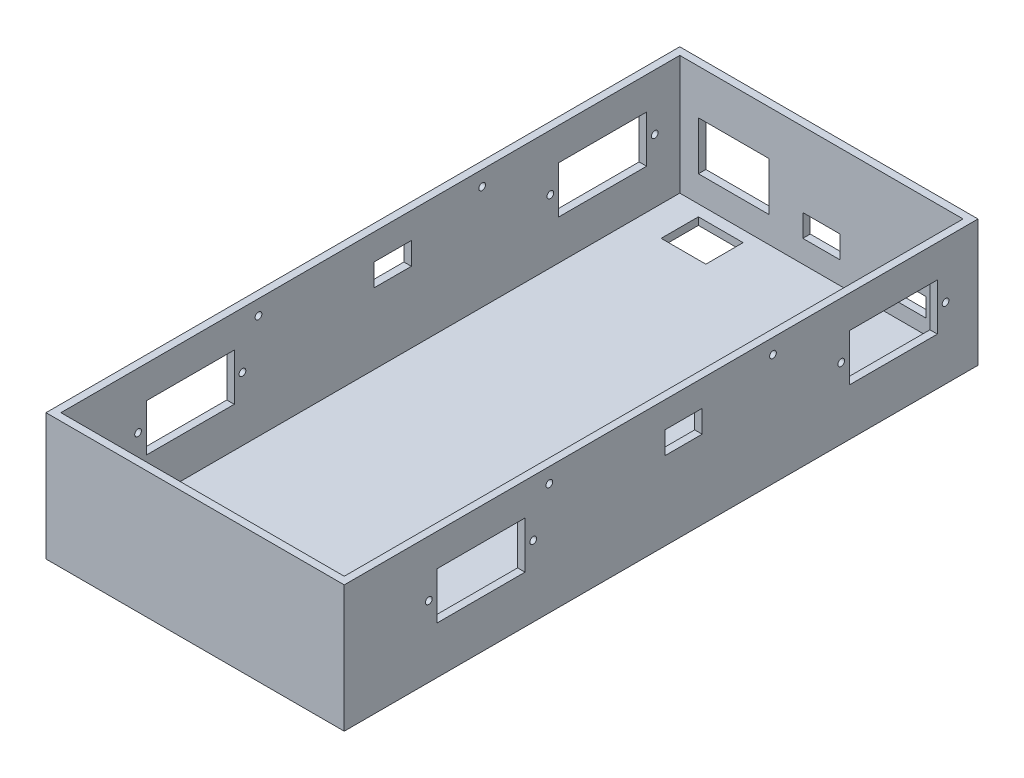
from build123d import *

# Parameters (mm, degrees)
BOSS_EXTRUDE1_START  = -85
SKETCH1_W            = 80
SKETCH1_H            = 34
BOSS_EXTRUDE1_DEPTH  = 170
BOSS_EXTRUDE2_START  = -83
SKETCH2_W            = 76
SKETCH2_H            = 38
BOSS_EXTRUDE2_DEPTH  = 166
BOSS_EXTRUDE3_START  = -45
SKETCH3_W            = 23.6
SKETCH3_H            = 12.6
BOSS_EXTRUDE3_DEPTH  = 90
BOSS_EXTRUDE4_START  = -45
SKETCH4_R            = 0.9
BOSS_EXTRUDE4_DEPTH  = 90
BOSS_EXTRUDE5_START  = -45
SKETCH5_R            = 0.9
BOSS_EXTRUDE5_DEPTH  = 90
BOSS_EXTRUDE6_START  = -45
SKETCH6_W            = 23.6
SKETCH6_H            = 12.6
BOSS_EXTRUDE6_DEPTH  = 90
BOSS_EXTRUDE7_START  = -45
SKETCH7_R            = 0.9
BOSS_EXTRUDE7_DEPTH  = 90
BOSS_EXTRUDE8_START  = -45
SKETCH8_R            = 0.9
BOSS_EXTRUDE8_DEPTH  = 90
BOSS_EXTRUDE9_START  = -45
SKETCH9_W            = 10
SKETCH9_H            = 6
BOSS_EXTRUDE9_DEPTH  = 90
BOSS_EXTRUDE10_START = -90
SKETCH10_W           = 10
SKETCH10_H           = 6
BOSS_EXTRUDE10_DEPTH = 10
BOSS_EXTRUDE11_START = -90
SKETCH11_W           = 10
SKETCH11_H           = 5
BOSS_EXTRUDE11_DEPTH = 10
BOSS_EXTRUDE12_START = -90
SKETCH12_W           = 19
SKETCH12_H           = 13
BOSS_EXTRUDE12_DEPTH = 10
BOSS_EXTRUDE13_START = 62
SKETCH13_W           = 12
SKETCH13_H           = 4
BOSS_EXTRUDE13_DEPTH = 10
BOSS_EXTRUDE14_START = 62
SKETCH14_W           = 12
SKETCH14_H           = 4
BOSS_EXTRUDE14_DEPTH = 10
BOSS_EXTRUDE15_START = -80
SKETCH15_W           = 12
SKETCH15_H           = 4
BOSS_EXTRUDE15_DEPTH = 10
BOSS_EXTRUDE16_START = -45
SKETCH16_R           = 0.9
BOSS_EXTRUDE16_DEPTH = 90
BOSS_EXTRUDE17_START = -45
SKETCH17_R           = 0.9
BOSS_EXTRUDE17_DEPTH = 90


with BuildPart() as part:
    # Sketch1 → Boss-Extrude1 (new body)
    with BuildSketch(Plane.XY.offset(BOSS_EXTRUDE1_START)):
        with Locations((0, 17)):
            Rectangle(SKETCH1_W, SKETCH1_H)
    extrude(amount=BOSS_EXTRUDE1_DEPTH)


with BuildPart() as body_2:
    # Sketch2 → Boss-Extrude2 (new body)
    with BuildSketch(Plane.XY.offset(BOSS_EXTRUDE2_START)):
        with Locations((0, 21)):
            Rectangle(SKETCH2_W, SKETCH2_H)
    extrude(amount=BOSS_EXTRUDE2_DEPTH)


with BuildPart() as part_1:
    add(part.part)

    # Combine1: cut body 2
    add(body_2.part, mode=Mode.SUBTRACT)


with BuildPart() as body_2_2:
    # Sketch3 → Boss-Extrude3 (new body)
    with BuildSketch(Plane(origin=(0, 0, 0), x_dir=(0, 0, -1), z_dir=(1, 0, 0)).offset(BOSS_EXTRUDE3_START)):
        with Locations((-48.3, 19)):
            Rectangle(SKETCH3_W, SKETCH3_H)
    extrude(amount=BOSS_EXTRUDE3_DEPTH)


with BuildPart() as part_2:
    add(part_1.part)

    # Combine2: cut body 2 2
    add(body_2_2.part, mode=Mode.SUBTRACT)


with BuildPart() as body_2_3:
    # Sketch4 → Boss-Extrude4 (new body)
    with BuildSketch(Plane(origin=(0, 0, 0), x_dir=(0, 0, -1), z_dir=(1, 0, 0)).offset(BOSS_EXTRUDE4_START)):
        with Locations((-34.3, 19)):
            Circle(SKETCH4_R)
    extrude(amount=BOSS_EXTRUDE4_DEPTH)


with BuildPart() as part_3:
    add(part_2.part)

    # Combine3: cut body 2 3
    add(body_2_3.part, mode=Mode.SUBTRACT)


with BuildPart() as body_2_4:
    # Sketch5 → Boss-Extrude5 (new body)
    with BuildSketch(Plane(origin=(0, 0, 0), x_dir=(0, 0, -1), z_dir=(1, 0, 0)).offset(BOSS_EXTRUDE5_START)):
        with Locations((-62.3, 19)):
            Circle(SKETCH5_R)
    extrude(amount=BOSS_EXTRUDE5_DEPTH)


with BuildPart() as part_4:
    add(part_3.part)

    # Combine4: cut body 2 4
    add(body_2_4.part, mode=Mode.SUBTRACT)


with BuildPart() as body_2_5:
    # Sketch6 → Boss-Extrude6 (new body)
    with BuildSketch(Plane(origin=(0, 0, 0), x_dir=(0, 0, -1), z_dir=(1, 0, 0)).offset(BOSS_EXTRUDE6_START)):
        with Locations((62.3, 19)):
            Rectangle(SKETCH6_W, SKETCH6_H)
    extrude(amount=BOSS_EXTRUDE6_DEPTH)


with BuildPart() as part_5:
    add(part_4.part)

    # Combine5: cut body 2 5
    add(body_2_5.part, mode=Mode.SUBTRACT)


with BuildPart() as body_2_6:
    # Sketch7 → Boss-Extrude7 (new body)
    with BuildSketch(Plane(origin=(0, 0, 0), x_dir=(0, 0, -1), z_dir=(1, 0, 0)).offset(BOSS_EXTRUDE7_START)):
        with Locations((76.3, 19)):
            Circle(SKETCH7_R)
    extrude(amount=BOSS_EXTRUDE7_DEPTH)


with BuildPart() as part_6:
    add(part_5.part)

    # Combine6: cut body 2 6
    add(body_2_6.part, mode=Mode.SUBTRACT)


with BuildPart() as body_2_7:
    # Sketch8 → Boss-Extrude8 (new body)
    with BuildSketch(Plane(origin=(0, 0, 0), x_dir=(0, 0, -1), z_dir=(1, 0, 0)).offset(BOSS_EXTRUDE8_START)):
        with Locations((48.3, 19)):
            Circle(SKETCH8_R)
    extrude(amount=BOSS_EXTRUDE8_DEPTH)


with BuildPart() as part_7:
    add(part_6.part)

    # Combine7: cut body 2 7
    add(body_2_7.part, mode=Mode.SUBTRACT)


with BuildPart() as body_2_8:
    # Sketch9 → Boss-Extrude9 (new body)
    with BuildSketch(Plane(origin=(0, 0, 0), x_dir=(0, 0, -1), z_dir=(1, 0, 0)).offset(BOSS_EXTRUDE9_START)):
        with Locations((6, 24)):
            Rectangle(SKETCH9_W, SKETCH9_H)
    extrude(amount=BOSS_EXTRUDE9_DEPTH)


with BuildPart() as part_8:
    add(part_7.part)

    # Combine8: cut body 2 8
    add(body_2_8.part, mode=Mode.SUBTRACT)


with BuildPart() as body_2_9:
    # Sketch10 → Boss-Extrude10 (new body)
    with BuildSketch(Plane.XY.offset(BOSS_EXTRUDE10_START)):
        with Locations((0, 11)):
            Rectangle(SKETCH10_W, SKETCH10_H)
    extrude(amount=BOSS_EXTRUDE10_DEPTH)


with BuildPart() as part_9:
    add(part_8.part)

    # Combine9: cut body 2 9
    add(body_2_9.part, mode=Mode.SUBTRACT)


with BuildPart() as body_2_10:
    # Sketch11 → Boss-Extrude11 (new body)
    with BuildSketch(Plane.XY.offset(BOSS_EXTRUDE11_START)):
        with Locations((23, 8.5)):
            Rectangle(SKETCH11_W, SKETCH11_H)
    extrude(amount=BOSS_EXTRUDE11_DEPTH)


with BuildPart() as part_10:
    add(part_9.part)

    # Combine10: cut body 2 10
    add(body_2_10.part, mode=Mode.SUBTRACT)


with BuildPart() as body_2_11:
    # Sketch12 → Boss-Extrude12 (new body)
    with BuildSketch(Plane.XY.offset(BOSS_EXTRUDE12_START)):
        with Locations((-23.5, 15.5)):
            Rectangle(SKETCH12_W, SKETCH12_H)
    extrude(amount=BOSS_EXTRUDE12_DEPTH)


with BuildPart() as part_11:
    add(part_10.part)

    # Combine11: cut body 2 11
    add(body_2_11.part, mode=Mode.SUBTRACT)


with BuildPart() as body_2_12:
    # Sketch13 → Boss-Extrude13 (new body)
    with BuildSketch(Plane.XY.offset(BOSS_EXTRUDE13_START)):
        with Locations((-30, 1)):
            Rectangle(SKETCH13_W, SKETCH13_H)
    extrude(amount=BOSS_EXTRUDE13_DEPTH)


with BuildPart() as part_12:
    add(part_11.part)

    # Combine12: cut body 2 12
    add(body_2_12.part, mode=Mode.SUBTRACT)


with BuildPart() as body_2_13:
    # Sketch14 → Boss-Extrude14 (new body)
    with BuildSketch(Plane.XY.offset(BOSS_EXTRUDE14_START)):
        with Locations((30, 1)):
            Rectangle(SKETCH14_W, SKETCH14_H)
    extrude(amount=BOSS_EXTRUDE14_DEPTH)


with BuildPart() as part_13:
    add(part_12.part)

    # Combine13: cut body 2 13
    add(body_2_13.part, mode=Mode.SUBTRACT)


with BuildPart() as body_2_14:
    # Sketch15 → Boss-Extrude15 (new body)
    with BuildSketch(Plane.XY.offset(BOSS_EXTRUDE15_START)):
        with Locations((-24, 1)):
            Rectangle(SKETCH15_W, SKETCH15_H)
    extrude(amount=BOSS_EXTRUDE15_DEPTH)


with BuildPart() as part_14:
    add(part_13.part)

    # Combine14: cut body 2 14
    add(body_2_14.part, mode=Mode.SUBTRACT)


with BuildPart() as body_2_15:
    # Sketch16 → Boss-Extrude16 (new body)
    with BuildSketch(Plane(origin=(0, 0, 0), x_dir=(0, 0, -1), z_dir=(1, 0, 0)).offset(BOSS_EXTRUDE16_START)):
        with Locations((30, 30)):
            Circle(SKETCH16_R)
    extrude(amount=BOSS_EXTRUDE16_DEPTH)


with BuildPart() as part_15:
    add(part_14.part)

    # Combine15: cut body 2 15
    add(body_2_15.part, mode=Mode.SUBTRACT)


with BuildPart() as body_2_16:
    # Sketch17 → Boss-Extrude17 (new body)
    with BuildSketch(Plane(origin=(0, 0, 0), x_dir=(0, 0, -1), z_dir=(1, 0, 0)).offset(BOSS_EXTRUDE17_START)):
        with Locations((-30, 30)):
            Circle(SKETCH17_R)
    extrude(amount=BOSS_EXTRUDE17_DEPTH)


with BuildPart() as part_16:
    add(part_15.part)

    # Combine16: cut body 2 16
    add(body_2_16.part, mode=Mode.SUBTRACT)


solid = part_16.part
